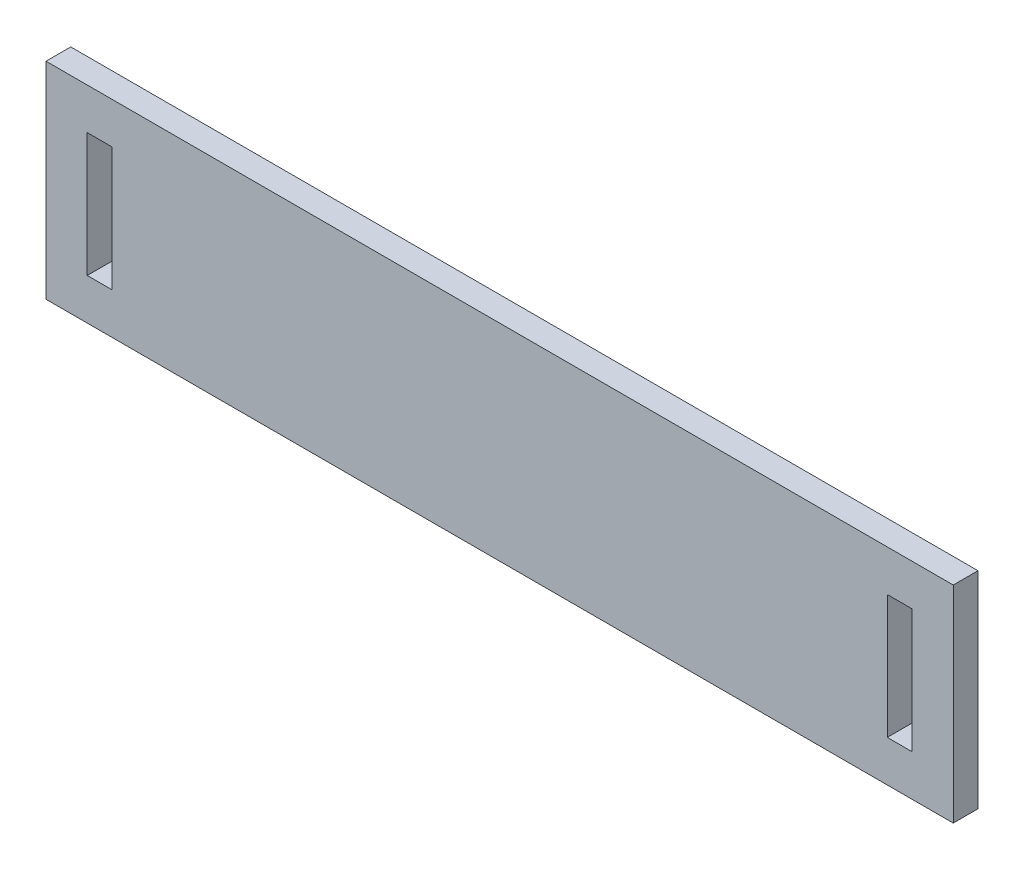
from build123d import *

# Parameters (mm, degrees)
SKETCH1_W           = 110
SKETCH1_H           = 25
BOSS_EXTRUDE1_DEPTH = 3
SKETCH3_W           = 3
SKETCH3_H           = 15
CUT_EXTRUDE1_DEPTH  = 57.482298112


with BuildPart() as part:
    # Sketch1 → Boss-Extrude1 (new body)
    with BuildSketch(Plane.XY):
        Rectangle(SKETCH1_W, SKETCH1_H)
    extrude(amount=BOSS_EXTRUDE1_DEPTH)

    # Sketch3 → Cut-Extrude1 (cut, through all)
    with BuildSketch(Plane(origin=(0, 0, 0), x_dir=(-1, 0, 0), z_dir=(0, 0, -1))):
        with Locations((48.5, 0)):
            Rectangle(SKETCH3_W, SKETCH3_H)
        with Locations((-48.5, 0)):
            Rectangle(SKETCH3_W, SKETCH3_H)
    extrude(amount=-CUT_EXTRUDE1_DEPTH, mode=Mode.SUBTRACT)


solid = part.part
